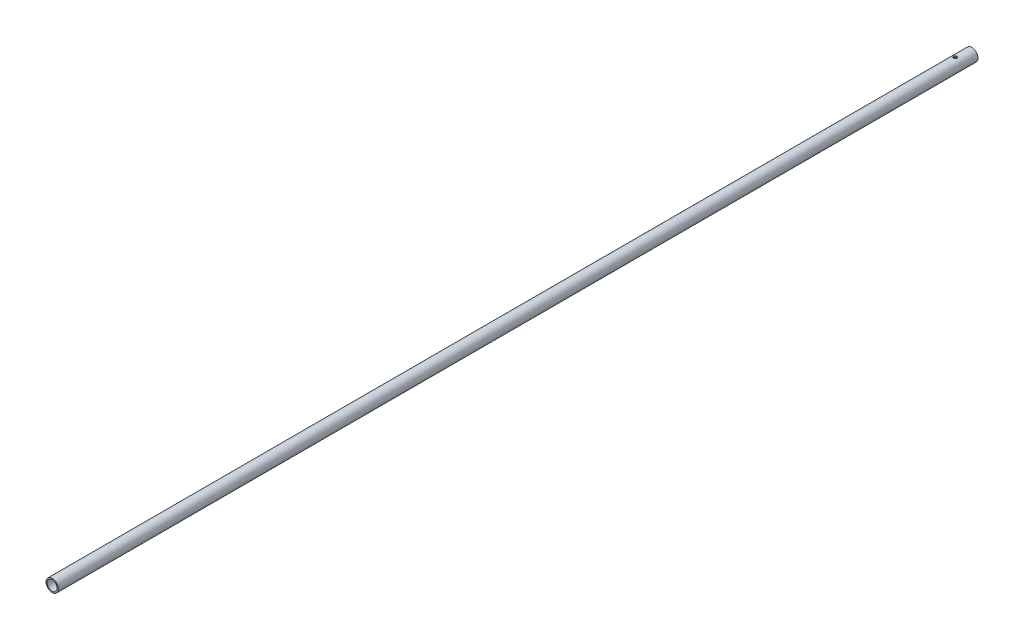
from build123d import *

# Parameters (mm, degrees)
SKETCH1_R                           = 3.7592
SKETCH1_R_2                         = 3.048
BOSS_EXTRUDE1_DEPTH                 = 558.8
CUT_EXTRUDE1_REACH                  = 560.825
CUT_EXTRUDE1_END_RADIUS             = 3.7592
SKETCH2_R                           = 1.016
CUT_EXTRUDE1_DIRECTION_2_REACH      = 560.825
CUT_EXTRUDE1_DIRECTION_2_END_RADIUS = 3.7592


with BuildPart() as part:
    # Sketch1 → Boss-Extrude1 (new body)
    with BuildSketch(Plane.XY):
        Circle(SKETCH1_R)
        Circle(SKETCH1_R_2, mode=Mode.SUBTRACT)
    extrude(amount=BOSS_EXTRUDE1_DEPTH)

    # Cut-Extrude1: up to this cylinder (the profile starts inside it)
    cut_extrude1_end = Plane(origin=(0, 0, 10.16), z_dir=(0, 0, -1)) * Cylinder(CUT_EXTRUDE1_END_RADIUS, 1130.1684, mode=Mode.PRIVATE)
    # Sketch2 → Cut-Extrude1 (cut, up to the surface)
    with BuildSketch(Plane(origin=(0, 0, 0), x_dir=(1, 0, 0), z_dir=(0, 1, 0)), mode=Mode.PRIVATE) as cut_extrude1_sk1:
        with Locations(Location((0, -10.16, 0), (0, 0, 270))):
            Circle(SKETCH2_R)
    cut_extrude1_tool1 = extrude(cut_extrude1_sk1.sketch, amount=-CUT_EXTRUDE1_REACH, mode=Mode.PRIVATE) & cut_extrude1_end
    add(cut_extrude1_tool1.solids().sort_by_distance((0, 0, 10.16))[0], mode=Mode.SUBTRACT)

    # Cut-Extrude1 direction 2: up to this cylinder (the profile starts inside it)
    cut_extrude1_direction_2_end = Plane(origin=(0, 0, 10.16), z_dir=(0, 0, -1)) * Cylinder(CUT_EXTRUDE1_DIRECTION_2_END_RADIUS, 1130.1684, mode=Mode.PRIVATE)
    # Sketch2 → Cut-Extrude1 direction 2 (cut, up to the surface)
    with BuildSketch(Plane(origin=(0, 0, 0), x_dir=(1, 0, 0), z_dir=(0, 1, 0)), mode=Mode.PRIVATE) as cut_extrude1_direction_2_sk1:
        with Locations(Location((0, -10.16, 0), (0, 0, 270))):
            Circle(SKETCH2_R)
    cut_extrude1_direction_2_tool1 = extrude(cut_extrude1_direction_2_sk1.sketch, amount=CUT_EXTRUDE1_DIRECTION_2_REACH, mode=Mode.PRIVATE) & cut_extrude1_direction_2_end
    add(cut_extrude1_direction_2_tool1.solids().sort_by_distance((0, 0, 10.16))[0], mode=Mode.SUBTRACT)


solid = part.part
